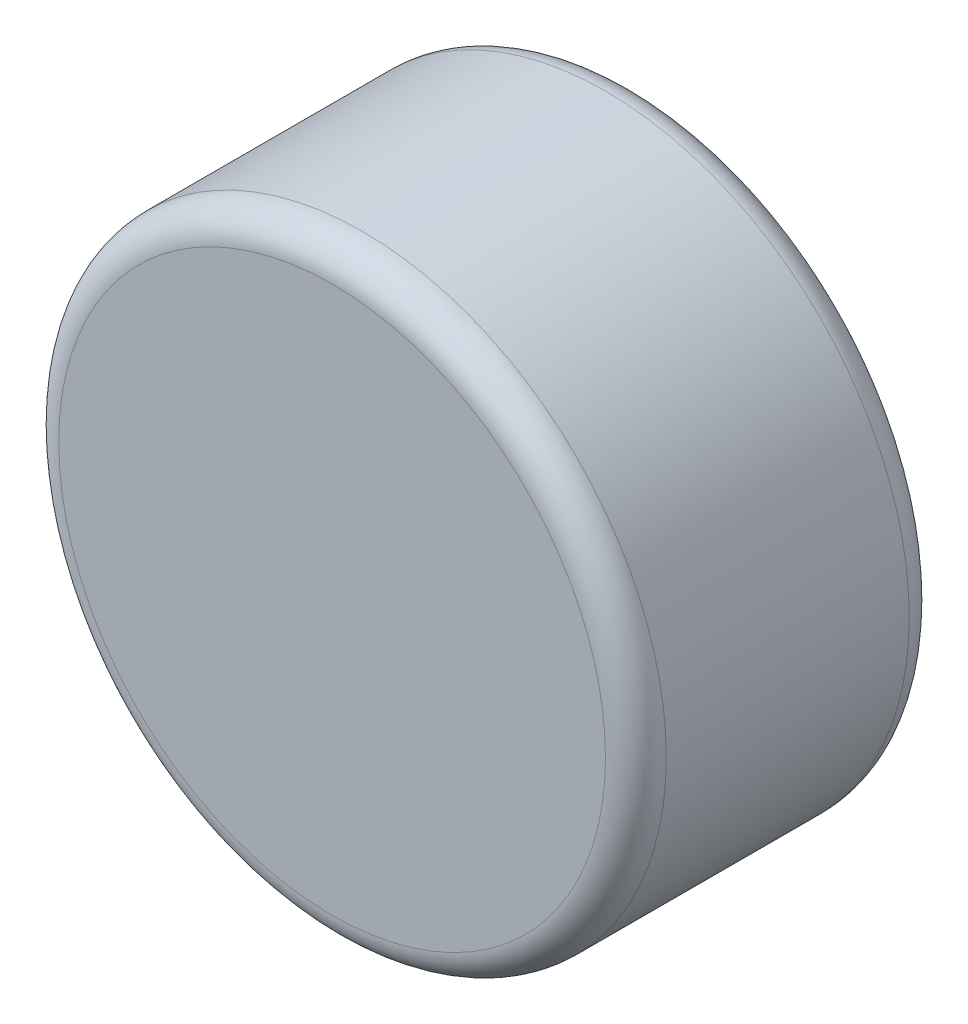
from build123d import *

# Parameters (mm, degrees)
SKETCH1_R           = 2
BOSS_EXTRUDE1_DEPTH = 2
FILLET1_R           = 0.2


with BuildPart() as part:
    # Sketch1 → Boss-Extrude1 (new body)
    with BuildSketch(Plane.XY):
        Circle(SKETCH1_R)
    extrude(amount=BOSS_EXTRUDE1_DEPTH)

    # Fillet1
    fillet1_edges = [part.edges().sort_by_distance(p)[0] for p in [
        (-2, 0, 0),
        (-2, 0, 2),
    ]]
    fillet(fillet1_edges, radius=FILLET1_R)


solid = part.part
